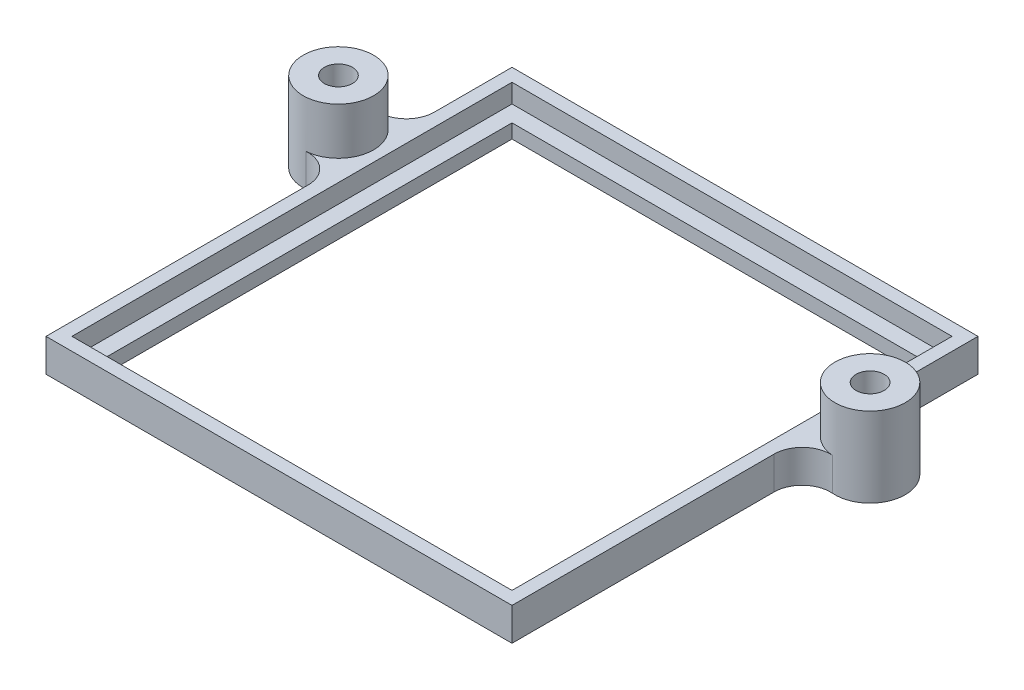
from build123d import *

# Parameters (mm, degrees)
SKETCH1_W           = 46.896511464
SKETCH1_H           = 46.896511464
SKETCH1_W_2         = 43.412298388
SKETCH1_H_2         = 43.412298388
BOSS_EXTRUDE1_DEPTH = 1.5
SKETCH1_3_W         = 49.664280744
SKETCH1_3_H         = 49.664280744
SKETCH1_3_W_2       = 46.896511464
SKETCH1_3_H_2       = 46.896511464
BOSS_EXTRUDE2_DEPTH = 3.5
BOSS_EXTRUDE4_START = -3.5
SKETCH2_R           = 3.75
SKETCH2_R_2         = 1.5
BOSS_EXTRUDE4_DEPTH = 8.5
FILLET2_R           = 3


with BuildPart() as part:
    # Sketch1 → Boss-Extrude1 (new body)
    with BuildSketch(Plane(origin=(0, 0, 0), x_dir=(1, 0, 0), z_dir=(0, 1, 0))):
        Rectangle(SKETCH1_W, SKETCH1_H)
        Rectangle(SKETCH1_W_2, SKETCH1_H_2, mode=Mode.SUBTRACT)
    extrude(amount=BOSS_EXTRUDE1_DEPTH)

    # Sketch1<3> → Boss-Extrude2 (add)
    with BuildSketch(Plane(origin=(0, 0, 0), x_dir=(1, 0, 0), z_dir=(0, 1, 0))):
        Rectangle(SKETCH1_3_W, SKETCH1_3_H)
        Rectangle(SKETCH1_3_W_2, SKETCH1_3_H_2, mode=Mode.SUBTRACT)
    extrude(amount=BOSS_EXTRUDE2_DEPTH)

    # Sketch2 → Boss-Extrude4 (add)
    # profile 1 of 2: a face of its own
    with BuildSketch(Plane(origin=(0, 3.5, 0), x_dir=(1, 0, 0), z_dir=(0, 1, 0)).offset(BOSS_EXTRUDE4_START)):
        with Locations(Location((-28.332140372, 9.832140372, 0), (0, 0, 270))):
            Circle(SKETCH2_R)
        with Locations(Location((-28.332140372, 9.832140372, 0), (0, 0, 270))):
            Circle(SKETCH2_R_2, mode=Mode.SUBTRACT)
    # profile 2 of 2: a face of its own
    with BuildSketch(Plane(origin=(0, 3.5, 0), x_dir=(1, 0, 0), z_dir=(0, 1, 0)).offset(BOSS_EXTRUDE4_START)):
        with Locations(Location((28.332140372, 9.832140372, 0), (0, 0, 201.039469781))):
            Circle(SKETCH2_R)
        with Locations(Location((28.332140372, 9.832140372, 0), (0, 0, 270))):
            Circle(SKETCH2_R_2, mode=Mode.SUBTRACT)
    extrude(amount=BOSS_EXTRUDE4_DEPTH)

    # Fillet2
    fillet2_edges = [part.edges().sort_by_distance(p)[0] for p in [
        (-24.832140372, 1.75, -8.48584917),
        (-24.832140372, 1.75, -11.178431574),
        (24.832140372, 1.75, -8.48584917),
        (24.832140372, 1.75, -11.178431574),
    ]]
    fillet(fillet2_edges, radius=FILLET2_R)


solid = part.part
